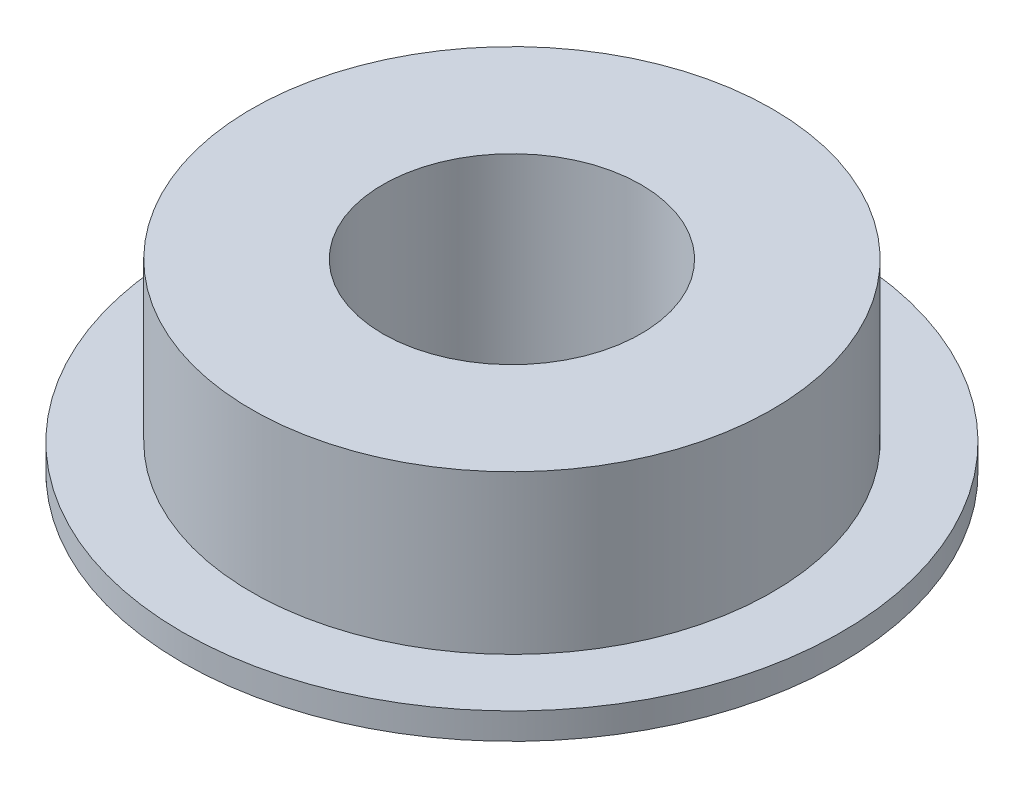
from build123d import *

# Parameters (mm, degrees)
SKETCH1_R           = 6.35
SKETCH1_R_2         = 2.4892
BOSS_EXTRUDE1_DEPTH = 0.508
SKETCH2_R           = 5.0165
SKETCH2_R_2         = 2.4892
BOSS_EXTRUDE2_DEPTH = 3.048


with BuildPart() as part:
    # Sketch1 → Boss-Extrude1 (new body)
    with BuildSketch(Plane(origin=(0, 0, 0), x_dir=(1, 0, 0), z_dir=(0, 1, 0))):
        with Locations(Location((0, 0, 0), (0, 0, 270))):
            Circle(SKETCH1_R)
        with Locations(Location((0, 0, 0), (0, 0, 270))):
            Circle(SKETCH1_R_2, mode=Mode.SUBTRACT)
    extrude(amount=BOSS_EXTRUDE1_DEPTH)

    # Sketch2 → Boss-Extrude2 (add)
    with BuildSketch(Plane(origin=(0, 0.508, 0), x_dir=(1, 0, 0), z_dir=(0, 1, 0))):
        with Locations(Location((0, 0, 0), (0, 0, 90))):
            Circle(SKETCH2_R)
        with Locations(Location((0, 0, 0), (0, 0, 270))):
            Circle(SKETCH2_R_2, mode=Mode.SUBTRACT)
    extrude(amount=BOSS_EXTRUDE2_DEPTH)


solid = part.part
